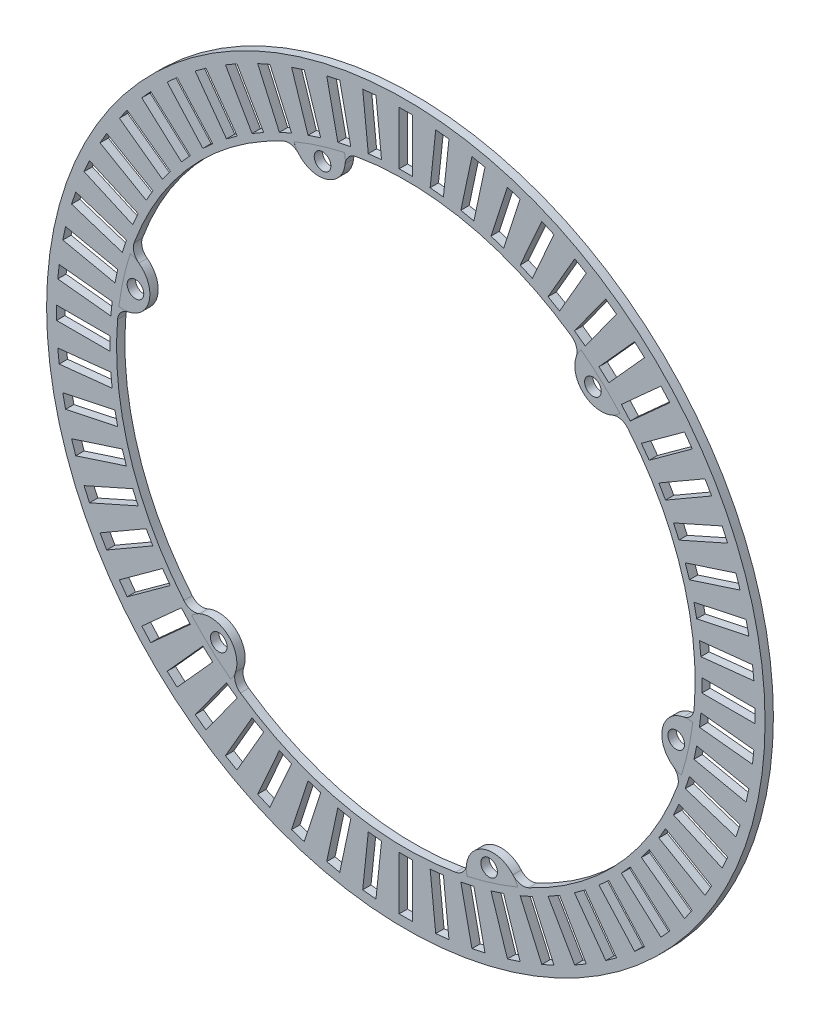
from build123d import *

# Parameters (mm, degrees)
SKETCH1_R                 = 68.500625
SKETCH1_R_2               = 55.165625
BOSS_EXTRUDE1_DEPTH       = 1.5875
SKETCH4_W                 = 2.54
SKETCH4_H                 = 10.16
CUT_EXTRUDE3_DEPTH        = 5.08
CIRPATTERN2_COUNT         = 60
BOSS_EXTRUDE2_START       = -1.5875
BOSS_EXTRUDE2_DEPTH       = 1.587512
FILLET1_R                 = 2.54
SKETCH9_R                 = 1.5875
CUT_EXTRUDE6_DEPTH        = 97.887519696
CIRPATTERN12_COUNT        = 6
FILLET1_OF_CIRPATTERN12_R = 2.54


with BuildPart() as part:
    # Sketch1 → Boss-Extrude1 (new body)
    with BuildSketch(Plane.XY):
        Circle(SKETCH1_R)
        Circle(SKETCH1_R_2, mode=Mode.SUBTRACT)
    extrude(amount=BOSS_EXTRUDE1_DEPTH)

    # Sketch4 → Cut-Extrude3 (cut)
    with BuildSketch(Plane.XY.offset(1.5875)):
        with Locations((0, 61.515625)):
            Rectangle(SKETCH4_W, SKETCH4_H)
    cut_extrude3 = extrude(amount=-CUT_EXTRUDE3_DEPTH, mode=Mode.SUBTRACT)

    # CirPattern2: Cut-Extrude3 ×60 about axis
    cirpattern2_axis = Axis((0, 0, 0), (0, 0, 1))
    for i in range(1, CIRPATTERN2_COUNT):
        add(cut_extrude3.rotate(cirpattern2_axis, i * 360 / CIRPATTERN2_COUNT), mode=Mode.SUBTRACT)

    # Sketch8 → Boss-Extrude2 (add)
    with BuildSketch(Plane.XY.offset(1.5875).offset(BOSS_EXTRUDE2_START)):
        with BuildLine():
            ThreePointArc((54.724288949, -6.964077875), (48.926905763, -10.846833867), (52.540195701, -16.815885863))
            ThreePointArc((52.540195701, -16.815885863), (53.857979418, -11.940026578), (54.724288949, -6.964077875))
        make_face()
    boss_extrude2 = extrude(amount=BOSS_EXTRUDE2_DEPTH)

    # Fillet1
    fillet1_edges = [part.edges().sort_by_distance(p)[0] for p in [
        (54.724288949, -6.964077875, 0.79375),
        (52.540195701, -16.815885863, 0.79375),
    ]]
    fillet(fillet1_edges, radius=FILLET1_R)

    # Sketch9 → Cut-Extrude6 (cut, symmetric)
    with BuildSketch(Plane.XY.offset(1.587512)):
        with Locations((51.55487273, -11.429440117)):
            Circle(SKETCH9_R)
    cut_extrude6 = extrude(amount=CUT_EXTRUDE6_DEPTH, both=True, mode=Mode.SUBTRACT)

    # CirPattern12: Boss-Extrude2, Cut-Extrude6 ×6 about axis
    cirpattern12_axis = Axis((0, 0, 0), (0, 0, 1))
    add([boss_extrude2.rotate(cirpattern12_axis, i * 360 / CIRPATTERN12_COUNT) for i in range(1, CIRPATTERN12_COUNT)])
    add([cut_extrude6.rotate(cirpattern12_axis, i * 360 / CIRPATTERN12_COUNT) for i in range(1, CIRPATTERN12_COUNT)], mode=Mode.SUBTRACT)

    # Fillet1 of CirPattern12
    fillet1_of_cirpattern12_edges = [part.edges().sort_by_distance(p)[0] for p in [
        (33.393212829, 43.910585496, 0.79375),
        (40.833082195, 37.093201266, 0.79375),
        (-21.33107612, 50.874663372, 0.79375),
        (-11.707113506, 53.909087128, 0.79375),
        (-54.724288949, 6.964077875, 0.79375),
        (-52.540195701, 16.815885863, 0.79375),
        (-33.393212829, -43.910585496, 0.79375),
        (-40.833082195, -37.093201266, 0.79375),
        (21.33107612, -50.874663372, 0.79375),
        (11.707113506, -53.909087128, 0.79375),
    ]]
    fillet(fillet1_of_cirpattern12_edges, radius=FILLET1_OF_CIRPATTERN12_R)


solid = part.part
